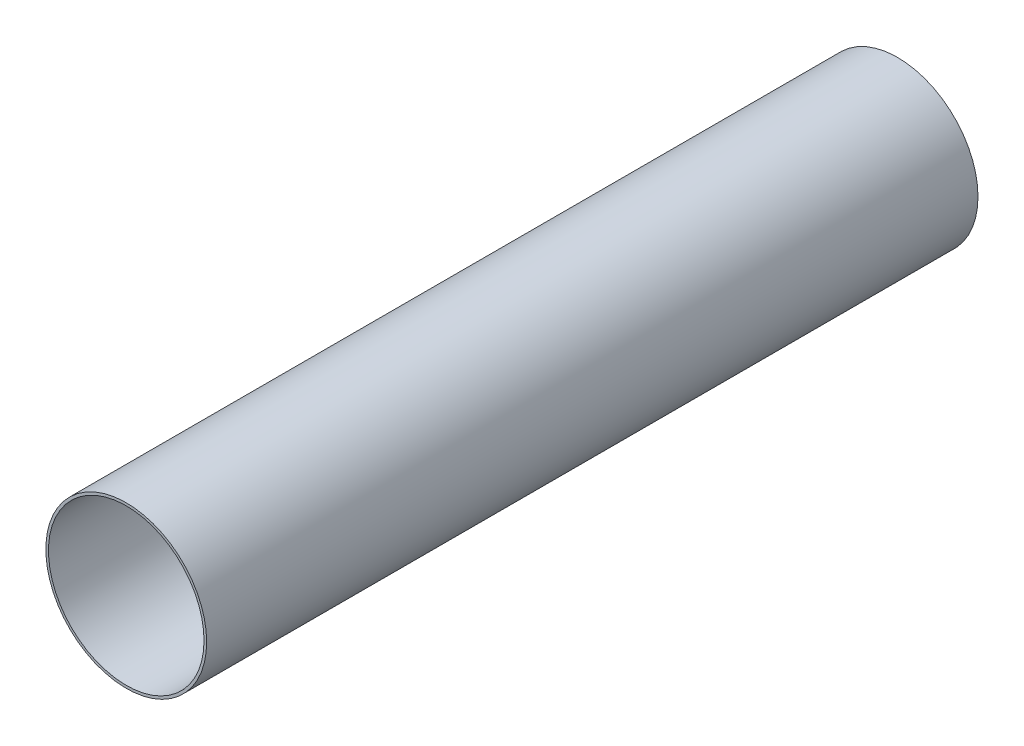
from build123d import *

# Parameters (mm, degrees)
SKETCH1_R           = 61.5
SKETCH1_R_2         = 59.5
BOSS_EXTRUDE1_DEPTH = 295


with BuildPart() as part:
    # Sketch1 → Boss-Extrude1 (new, symmetric)
    with BuildSketch(Plane.XY):
        Circle(SKETCH1_R)
        Circle(SKETCH1_R_2, mode=Mode.SUBTRACT)
    extrude(amount=BOSS_EXTRUDE1_DEPTH, both=True)


solid = part.part
